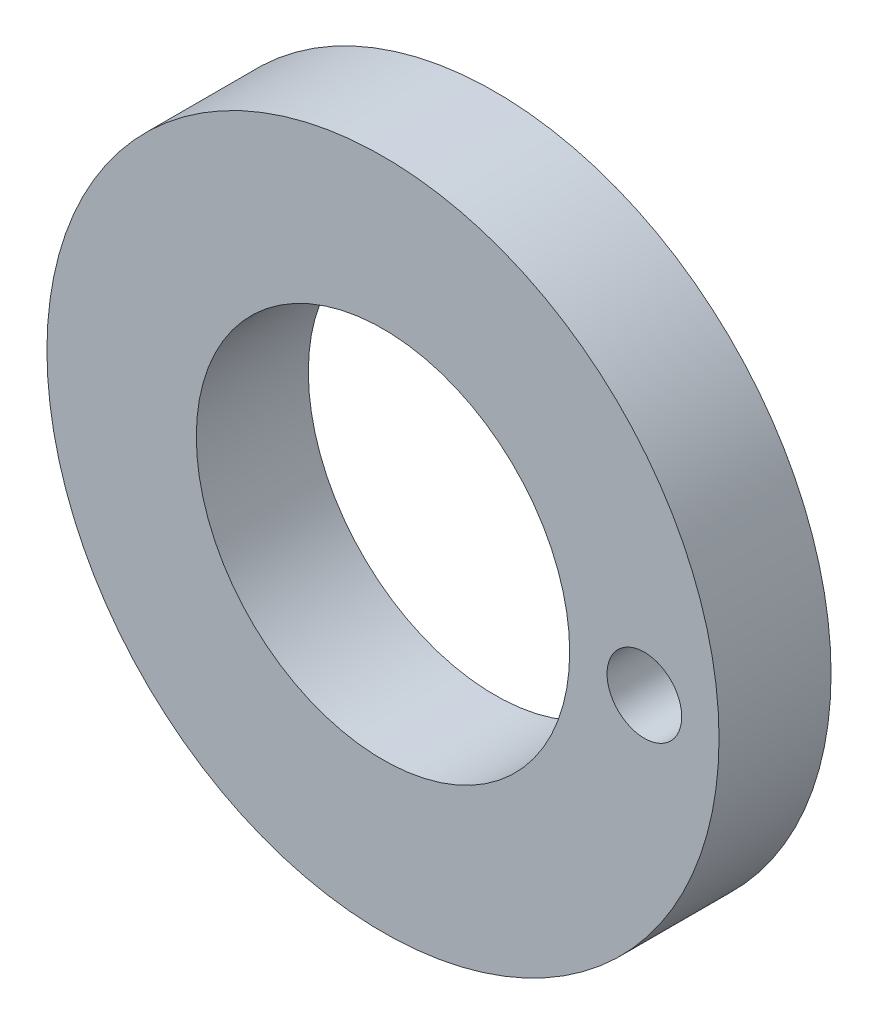
from build123d import *

# Parameters (mm, degrees)
SKETCH1_R           = 90
BOSS_EXTRUDE1_DEPTH = 30
SKETCH2_R           = 50
CUT_EXTRUDE1_DEPTH  = 70
SKETCH3_R           = 10
CUT_EXTRUDE2_DEPTH  = 70


with BuildPart() as part:
    # Sketch1 → Boss-Extrude1 (new body)
    with BuildSketch(Plane.XY):
        Circle(SKETCH1_R)
    extrude(amount=BOSS_EXTRUDE1_DEPTH)

    # Sketch2 → Cut-Extrude1 (cut)
    with BuildSketch(Plane.XY):
        Circle(SKETCH2_R)
    extrude(amount=CUT_EXTRUDE1_DEPTH, mode=Mode.SUBTRACT)

    # Sketch3 → Cut-Extrude2 (cut)
    with BuildSketch(Plane.XY.offset(30)):
        with Locations((70, 0)):
            Circle(SKETCH3_R)
    extrude(amount=-CUT_EXTRUDE2_DEPTH, mode=Mode.SUBTRACT)


solid = part.part
